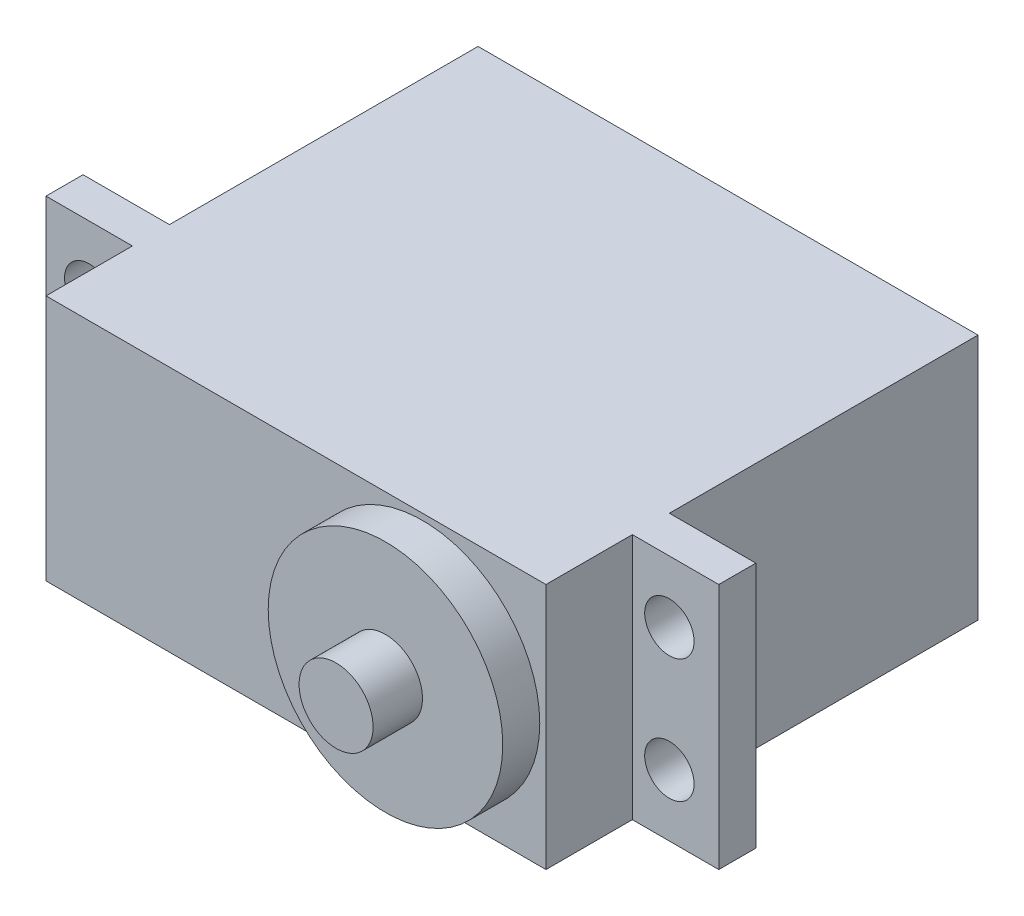
from build123d import *

# Parameters (mm, degrees)
SKETCH_1_W                            = 40.5
SKETCH_1_H                            = 20
MG995_CASE_PHOTO_APPROX35_DEPTH       = 35
MOUNTING_EARS_APPROX54P5_START        = 25
SKETCH_2_W                            = 54.5
SKETCH_2_H                            = 20
MOUNTING_EARS_APPROX54P5_DEPTH        = 3
SKETCH_3_R                            = 9.5
RAISED_COVER_APPROX_DEPTH             = 38
SKETCH_4_R                            = 3
OUTPUT_SHAFT_ENVELOPE_NO_SPLINE_DEPTH = 42
EAR_HOLES_REFERENCE_47X10_DEPTH       = 58.18609971
EAR_HOLES_REFERENCE_47X10_DEPTH_BACK  = 58.18609971
SKETCH_5_R                            = 2


with BuildPart() as part:
    # 草图1 → MG995_case_photo_approx35 (new body)
    with BuildSketch(Plane.XY):
        with Locations((-10.25, 0)):
            Rectangle(SKETCH_1_W, SKETCH_1_H)
    extrude(amount=MG995_CASE_PHOTO_APPROX35_DEPTH)

    # 草图2 → Mounting_ears_APPROX54p5 (add)
    with BuildSketch(Plane.XY.offset(MOUNTING_EARS_APPROX54P5_START)):
        with Locations((-10.25, 0)):
            Rectangle(SKETCH_2_W, SKETCH_2_H)
    extrude(amount=MOUNTING_EARS_APPROX54P5_DEPTH)

    # 草图3 → Raised_cover_APPROX (add)
    with BuildSketch(Plane.XY):
        with Locations(Location((0, 0, 0), (0, 0, 180))):
            Circle(SKETCH_3_R)
    extrude(amount=RAISED_COVER_APPROX_DEPTH)

    # 草图4 → Output_shaft_envelope_NO_SPLINE (add)
    with BuildSketch(Plane.XY):
        with Locations(Location((0, 0, 0), (0, 0, 180))):
            Circle(SKETCH_4_R)
    extrude(amount=OUTPUT_SHAFT_ENVELOPE_NO_SPLINE_DEPTH)

    # 草图5 → Ear_holes_REFERENCE_47x10 (cut, two sides: drawn at the far end of the back side and taken through both)
    with BuildSketch(Plane.XY.offset(-EAR_HOLES_REFERENCE_47X10_DEPTH_BACK)):
        with Locations((-34, -5)):
            Circle(SKETCH_5_R)
        with Locations((-34, 5)):
            Circle(SKETCH_5_R)
        with Locations((13, -5)):
            Circle(SKETCH_5_R)
        with Locations((13, 5)):
            Circle(SKETCH_5_R)
    extrude(amount=EAR_HOLES_REFERENCE_47X10_DEPTH + EAR_HOLES_REFERENCE_47X10_DEPTH_BACK, mode=Mode.SUBTRACT)


solid = part.part
